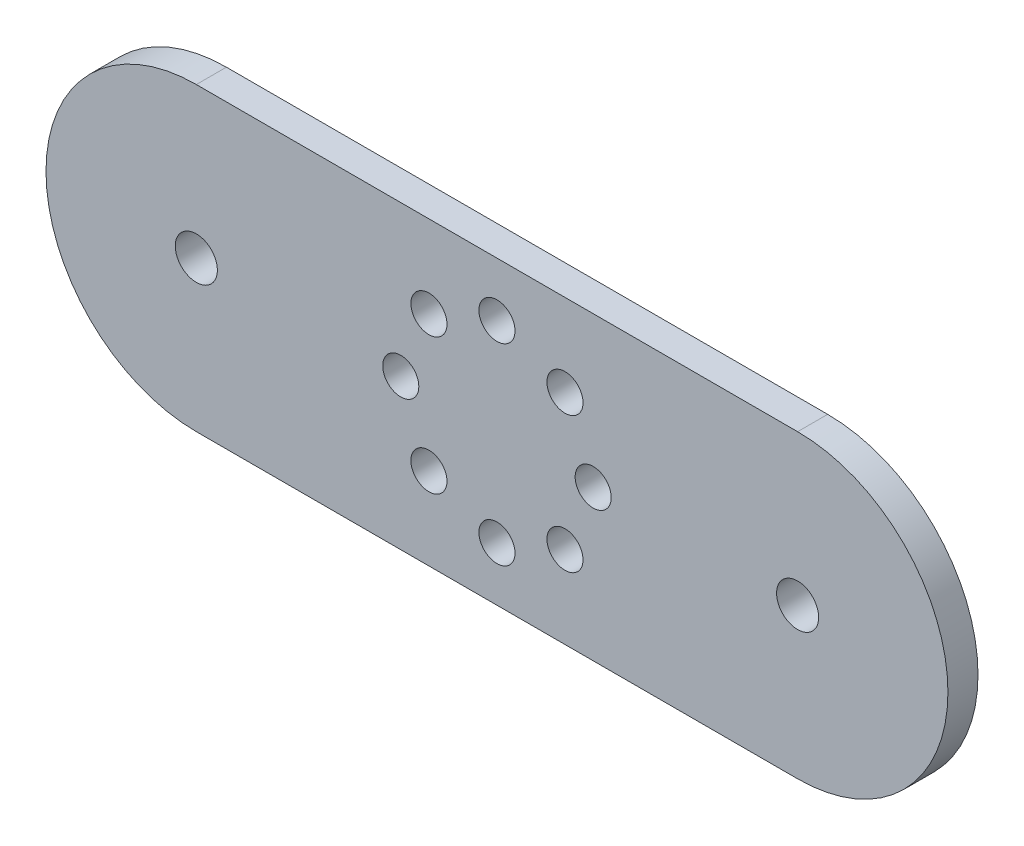
from build123d import *

# Parameters (mm, degrees)
SKETCH_1_R      = 3
SKETCH_1_R_2    = 3.5
EXTRUDE_1_DEPTH = 5


with BuildPart() as part:
    # 草图1 → 凸台-拉伸1 (new body)
    with BuildSketch(Plane.XY):
        with BuildLine():
            Line((-50, 25), (50, 25))
            ThreePointArc((50, 25), (75, 0), (50, -25))
            Line((50, -25), (-50, -25))
            ThreePointArc((-50, -25), (-75, 0), (-50, 25))
        make_face()
        with Locations((16, 0)):
            Circle(SKETCH_1_R, mode=Mode.SUBTRACT)
        with Locations((11.313708499, -11.313708499)):
            Circle(SKETCH_1_R, mode=Mode.SUBTRACT)
        with Locations((0, -16)):
            Circle(SKETCH_1_R, mode=Mode.SUBTRACT)
        with Locations((-11.313708499, -11.313708499)):
            Circle(SKETCH_1_R, mode=Mode.SUBTRACT)
        with Locations((-16, 0)):
            Circle(SKETCH_1_R, mode=Mode.SUBTRACT)
        with Locations((-11.313708499, 11.313708499)):
            Circle(SKETCH_1_R, mode=Mode.SUBTRACT)
        with Locations((0, 16)):
            Circle(SKETCH_1_R, mode=Mode.SUBTRACT)
        with Locations((11.313708499, 11.313708499)):
            Circle(SKETCH_1_R, mode=Mode.SUBTRACT)
        with Locations((-50, 0)):
            Circle(SKETCH_1_R_2, mode=Mode.SUBTRACT)
        with Locations((50, 0)):
            Circle(SKETCH_1_R_2, mode=Mode.SUBTRACT)
    extrude(amount=EXTRUDE_1_DEPTH)


solid = part.part
